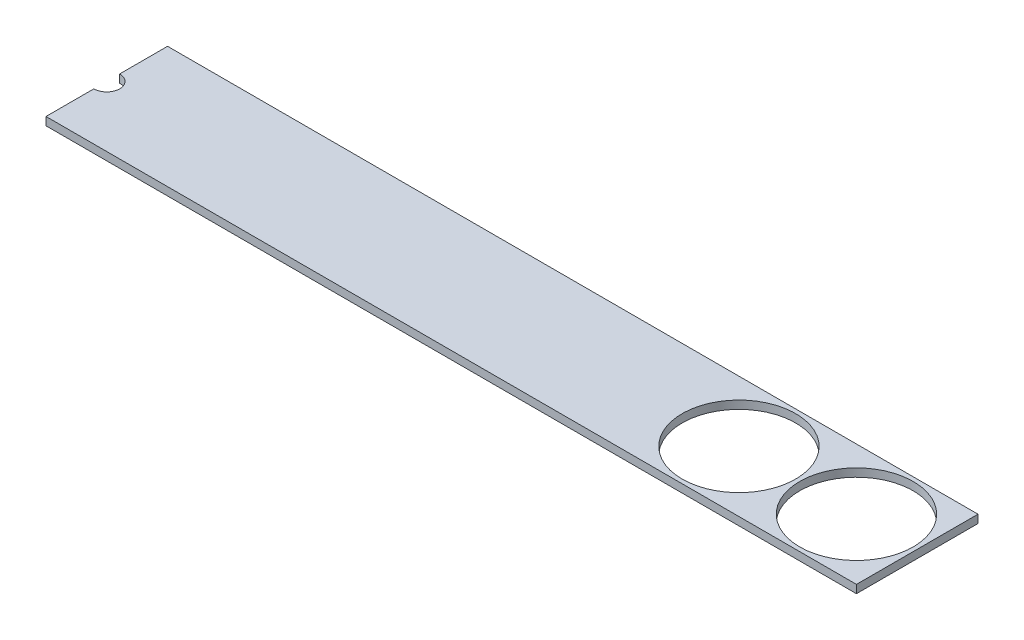
from build123d import *

# Parameters (mm, degrees)
SKETCH1_W           = 200
SKETCH1_H           = 30
SKETCH1_R           = 14
BOSS_EXTRUDE3_DEPTH = 2
SKETCH1_7_R         = 3.185
CUT_EXTRUDE1_DEPTH  = 10


with BuildPart() as part:
    # Sketch1 → Boss-Extrude3 (new body)
    with BuildSketch(Plane(origin=(0, 0, 0), x_dir=(1, 0, 0), z_dir=(0, 1, 0))):
        Rectangle(SKETCH1_W, SKETCH1_H)
        with Locations((85, 0)):
            Circle(SKETCH1_R, mode=Mode.SUBTRACT)
        with Locations((56, 0)):
            Circle(SKETCH1_R, mode=Mode.SUBTRACT)
    extrude(amount=BOSS_EXTRUDE3_DEPTH)

    # Sketch1<7> → Cut-Extrude1 (cut)
    with BuildSketch(Plane(origin=(0, 0, 0), x_dir=(1, 0, 0), z_dir=(0, 1, 0))):
        with Locations((-100, 0)):
            Circle(SKETCH1_7_R)
    extrude(amount=CUT_EXTRUDE1_DEPTH, mode=Mode.SUBTRACT)


solid = part.part
